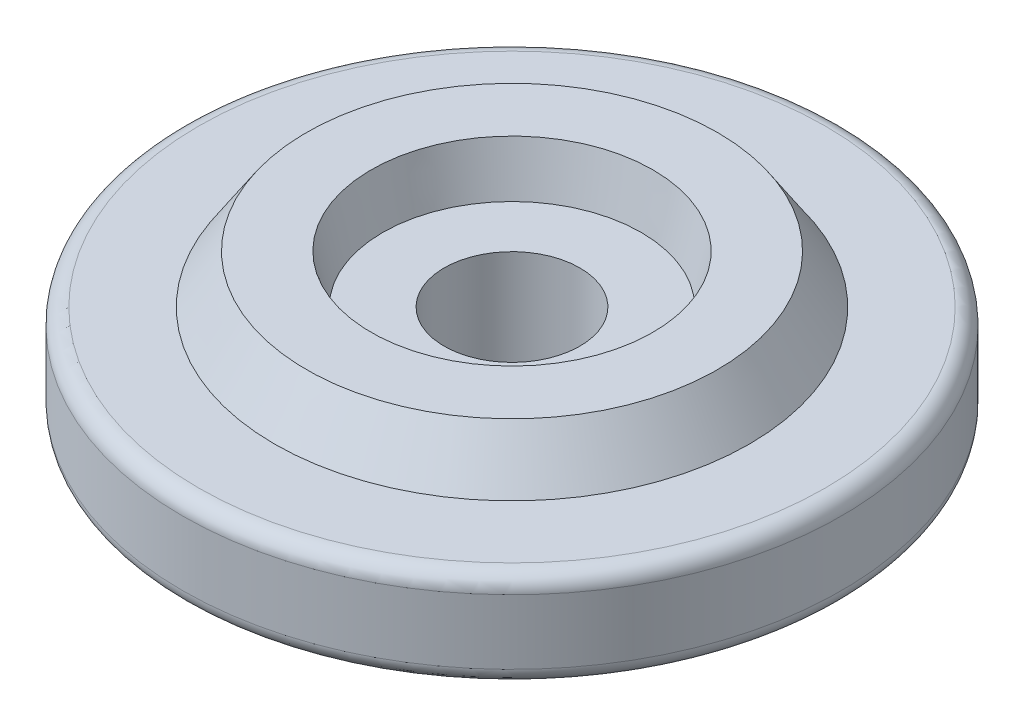
from build123d import *


with BuildPart() as part:
    # Sketch1 → Revolve1 (revolve)
    with BuildSketch(Plane.XY, mode=Mode.PRIVATE) as revolve1_sk:
        with BuildLine():
            Line((2.1, 0), (2.1, 3))
            Line((2.1, 3), (4, 3))
            Line((4, 3), (4.359369746, 4.5))
            Line((4.359369746, 4.5), (6.359369746, 4.5))
            Line((6.359369746, 4.5), (7.347987035, 3))
            Line((7.347987035, 3), (9.7, 3))
            ThreePointArc((9.7, 3), (10.053553391, 2.853553391), (10.2, 2.5))
            Line((10.2, 2.5), (10.2, 0.5))
            ThreePointArc((10.2, 0.5), (10.053553391, 0.146446609), (9.7, 0))
            Line((9.7, 0), (2.1, 0))
        make_face()
    revolve(revolve1_sk.sketch.rotate(Axis((0, 0, 0), (0, 1, 0)), 90), axis=Axis((0, 0, 0), (0, 1, 0)))


solid = part.part
